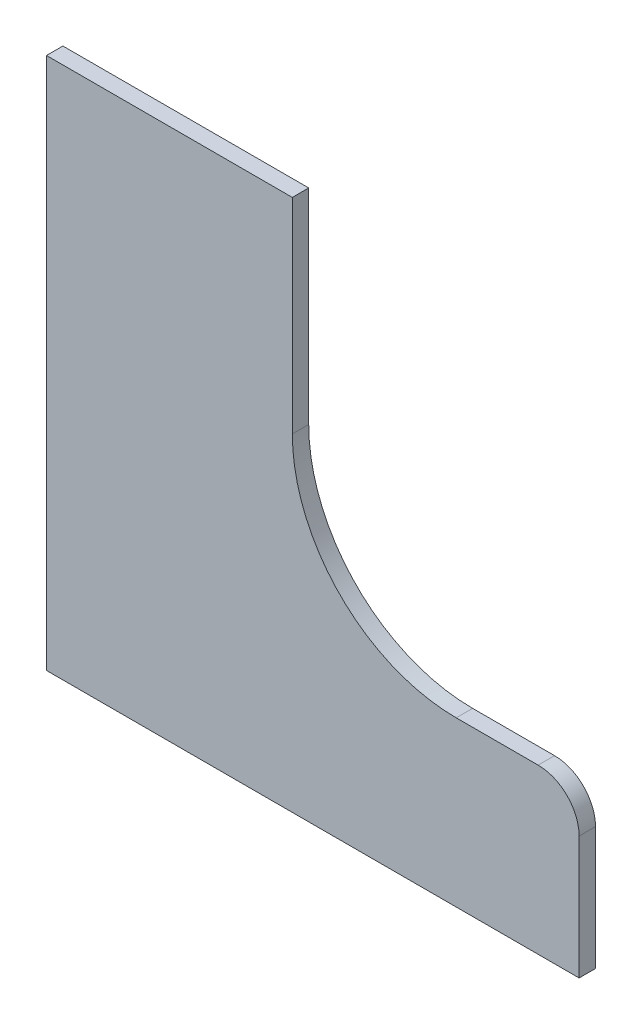
from build123d import *

# Parameters (mm, degrees)
BOSS_EXTRUDE1_DEPTH = 20
FILLET1_R           = 50


with BuildPart() as part:
    # Sketch1 → Boss-Extrude1 (new body)
    with BuildSketch(Plane.XY):
        with BuildLine():
            Line((-482.666666667, 166), (-182.666666667, 166))
            Line((-182.666666667, 166), (-182.666666667, -84))
            ThreePointArc((-182.666666667, -84), (-124.088022904, -225.421356237), (17.333333333, -284))
            Line((17.333333333, -284), (167.333333333, -284))
            Line((167.333333333, -284), (167.333333333, -484))
            Line((167.333333333, -484), (-482.666666667, -484))
            Line((-482.666666667, -484), (-482.666666667, 166))
        make_face()
    extrude(amount=BOSS_EXTRUDE1_DEPTH)

    # Fillet1
    fillet1_edges = [part.edges().sort_by_distance(p)[0] for p in [
        (167.333333333, -284, 10),
    ]]
    fillet(fillet1_edges, radius=FILLET1_R)


solid = part.part
